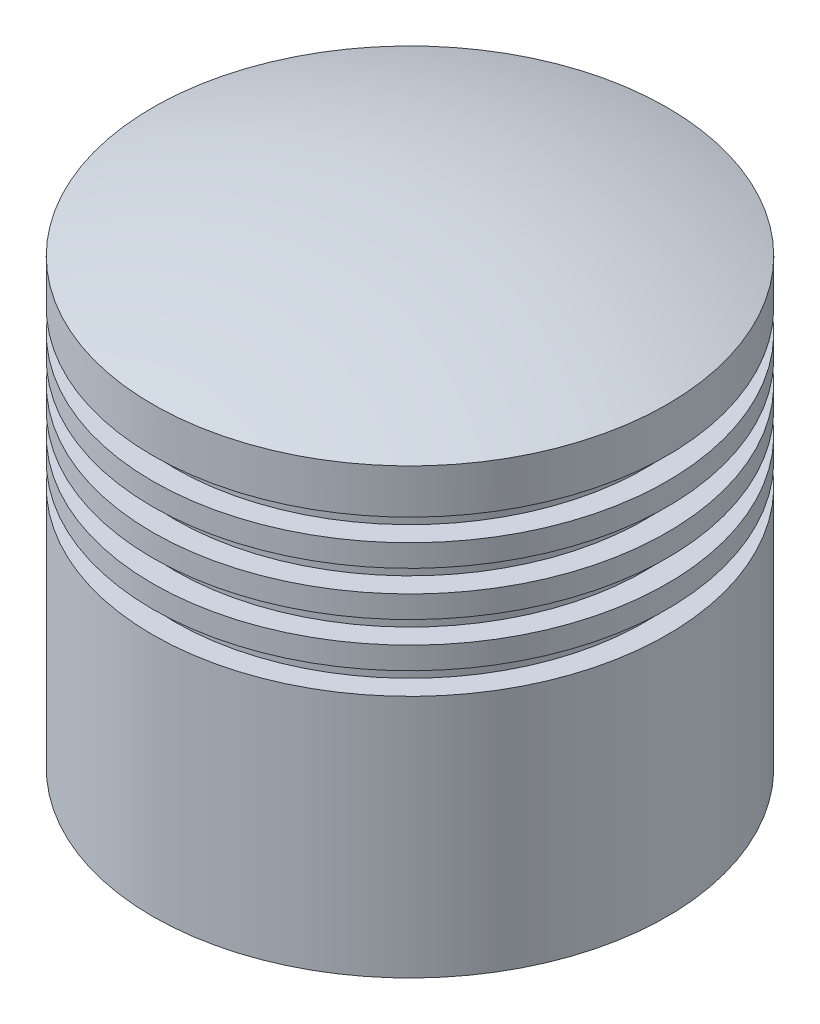
from build123d import *


with BuildPart() as part:
    # Sketch1 → Revolve1 (revolve)
    with BuildSketch(Plane.XY, mode=Mode.PRIVATE) as revolve1_sk:
        with BuildLine():
            Line((58, 0), (58, 55))
            Line((58, 55), (53, 55))
            Line((53, 55), (53, 60))
            Line((53, 60), (58, 60))
            Line((58, 60), (58, 65))
            Line((58, 65), (53, 65))
            Line((53, 65), (53, 70))
            Line((53, 70), (58, 70))
            Line((58, 70), (58, 75))
            Line((58, 75), (53, 75))
            Line((53, 75), (53, 80))
            Line((53, 80), (58, 80))
            Line((58, 80), (58, 85))
            Line((58, 85), (53, 85))
            Line((53, 85), (53, 90))
            Line((53, 90), (58, 90))
            Line((58, 90), (58, 100))
            ThreePointArc((58, 100), (29.445044376, 107.630676018), (0, 110.200125156))
            Line((0, 110.200125156), (0, 103.200125156))
            ThreePointArc((0, 103.200125156), (21.692969078, 101.750164131), (43, 97.426077213))
            Line((43, 97.426077213), (43, 30))
            Line((43, 30), (50, 30))
            Line((50, 30), (50, 0))
            Line((50, 0), (58, 0))
        make_face()
    revolve(revolve1_sk.sketch.rotate(Axis((0, 0, 0), (0, 1, 0)), 90), axis=Axis((0, 0, 0), (0, 1, 0)))


solid = part.part
